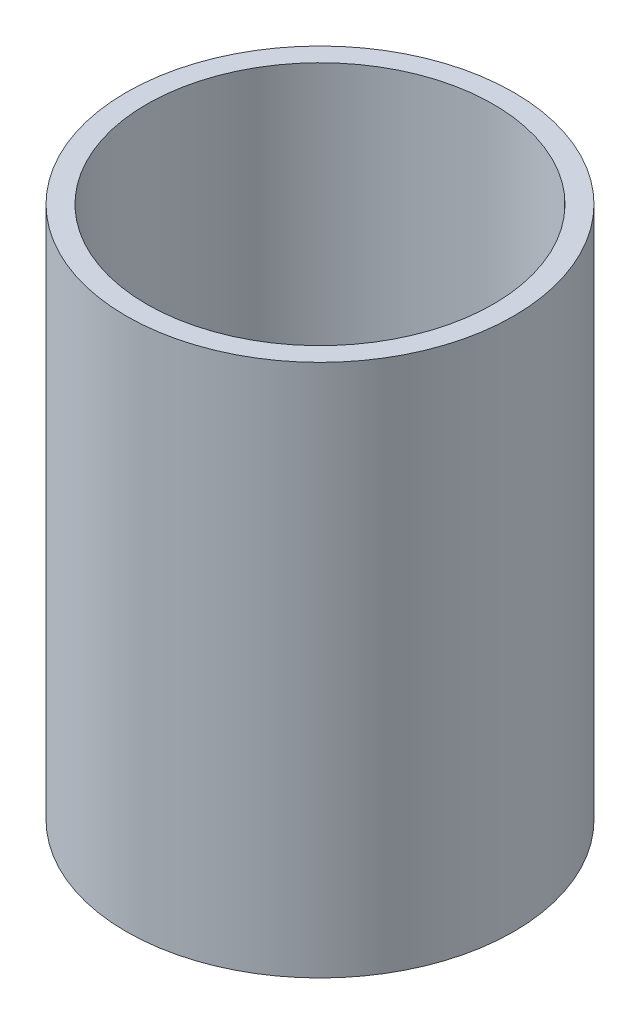
from build123d import *

# Parameters (mm, degrees)
SKETCH1_R           = 15.99
SKETCH1_R_2         = 14.3
BOSS_EXTRUDE1_DEPTH = 44


with BuildPart() as part:
    # Sketch1 → Boss-Extrude1 (new body)
    with BuildSketch(Plane(origin=(0, 0, 0), x_dir=(1, 0, 0), z_dir=(0, 1, 0))):
        with Locations(Location((0, 0, 0), (0, 0, 270))):
            Circle(SKETCH1_R)
        with Locations(Location((0, 0, 0), (0, 0, 270))):
            Circle(SKETCH1_R_2, mode=Mode.SUBTRACT)
    extrude(amount=BOSS_EXTRUDE1_DEPTH)


solid = part.part
